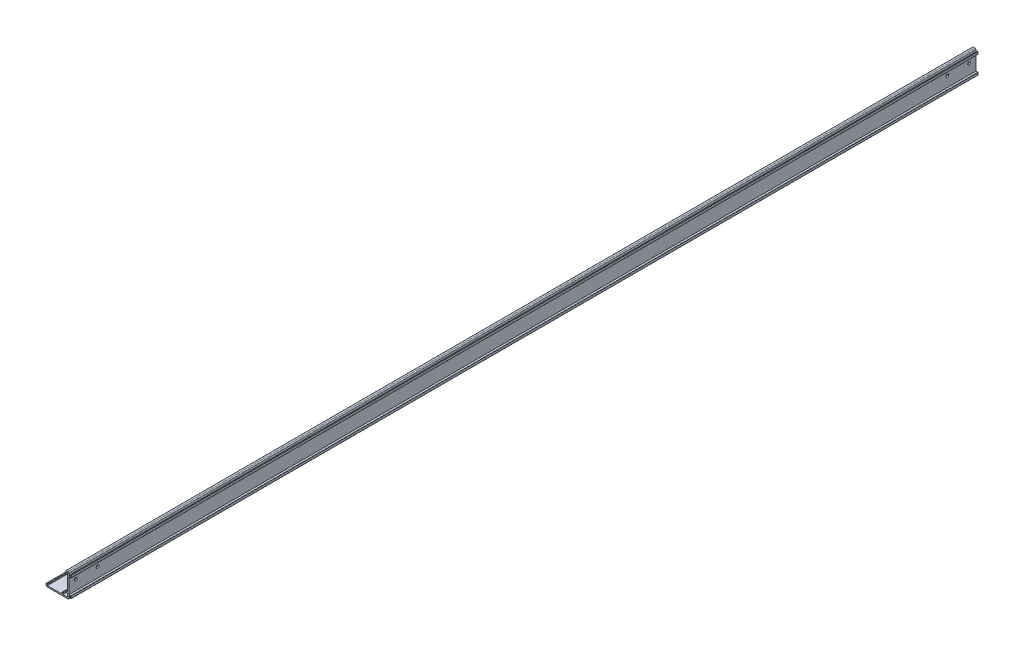
from build123d import *

# Parameters (mm, degrees)
MAIN_W                 = 46.736
MAIN_H                 = 1689.1
EXTRUDE_MAIN_DEPTH     = 44.45
MAIN_CUT_W             = 37.338
MAIN_CUT_H             = 39.37
CUT_MAIN_DEPTH         = 1690.846346839
BOTTOM_LEFT_W          = 26.67
BOTTOM_LEFT_H          = 2.667
CUT_BOTTOM_LEFT_DEPTH  = 1690.846346839
BOTTOM_RIGHT_W         = 6.096
BOTTOM_RIGHT_H         = 2.667
CUT_BOTTOM_RIGHT_DEPTH = 1690.846346839
LEFT_BOTTOM_W          = 3.048
LEFT_BOTTOM_H          = 6.858
CUT_LEFT_BOTTOM_DEPTH  = 1690.846346839
LEFT_MIDDLE_W          = 3.048
LEFT_MIDDLE_H          = 30.48
CUT_LEFT_MID_DEPTH     = 1690.846346839
RIGHT_MIDDLE_W         = 7.874
RIGHT_MIDDLE_H         = 28.702
CUT_RIGHT_MID_DEPTH    = 1690.846346839
HOOK_CUT_DEPTH         = 1690.846346839
FILLET3_R              = 1.905
FILLET4_R              = 0.508
SCREW_HOLES_D          = 5.3086


with BuildPart() as part:
    # Main → Extrude-Main (new body)
    with BuildSketch(Plane(origin=(0, 0, 0), x_dir=(1, 0, 0), z_dir=(0, 1, 0))):
        Rectangle(MAIN_W, MAIN_H)
    extrude(amount=EXTRUDE_MAIN_DEPTH)

    # Main Cut → Cut-Main (cut, through all)
    with BuildSketch(Plane.XY.offset(844.55)):
        with Locations((-4.699, 24.765)):
            Rectangle(MAIN_CUT_W, MAIN_CUT_H)
    extrude(amount=-CUT_MAIN_DEPTH, mode=Mode.SUBTRACT)

    # Bottom Left → Cut-Bottom Left (cut, through all)
    with BuildSketch(Plane.XY.offset(844.55)):
        with Locations((-7.493, 3.7465)):
            Rectangle(BOTTOM_LEFT_W, BOTTOM_LEFT_H)
    extrude(amount=-CUT_BOTTOM_LEFT_DEPTH, mode=Mode.SUBTRACT)

    # Bottom Right → Cut-Bottom Right (cut, through all)
    with BuildSketch(Plane.XY.offset(844.55)):
        with Locations((10.922, 3.7465)):
            Rectangle(BOTTOM_RIGHT_W, BOTTOM_RIGHT_H)
    extrude(amount=-CUT_BOTTOM_RIGHT_DEPTH, mode=Mode.SUBTRACT)

    # Left Bottom → Cut-Left Bottom (cut, through all)
    with BuildSketch(Plane.XY.offset(844.55)):
        with Locations((15.494, 5.842)):
            Rectangle(LEFT_BOTTOM_W, LEFT_BOTTOM_H)
    extrude(amount=-CUT_LEFT_BOTTOM_DEPTH, mode=Mode.SUBTRACT)

    # Left Middle → Cut-Left Mid (cut, through all)
    with BuildSketch(Plane.XY.offset(844.55)):
        with Locations((15.494, 26.730206209)):
            Rectangle(LEFT_MIDDLE_W, LEFT_MIDDLE_H)
    extrude(amount=-CUT_LEFT_MID_DEPTH, mode=Mode.SUBTRACT)

    # Right Middle → Cut-Right Mid (cut, through all)
    with BuildSketch(Plane.XY.offset(844.55)):
        with Locations((23.368, 22.225)):
            Rectangle(RIGHT_MIDDLE_W, RIGHT_MIDDLE_H)
    extrude(amount=-CUT_RIGHT_MID_DEPTH, mode=Mode.SUBTRACT)

    # Hooks → Hook Cut (cut, through all)
    with BuildSketch(Plane.XY.offset(844.55)):
        Polygon((19.431, 44.45), (19.431, 38.1635), (21.7805, 38.1635), (21.7805, 41.402), (23.368, 41.402), (23.368, 44.45), align=None)
        Polygon((23.368, 3.048), (23.368, 0), (19.431, 0), (19.431, 6.2865), (21.7805, 6.2865), (21.7805, 3.048), align=None)
    extrude(amount=-HOOK_CUT_DEPTH, mode=Mode.SUBTRACT)

    # Fillet3
    fillet3_edges = [part.edges().sort_by_distance(p)[0] for p in [
        (19.431, 44.45, 0),
        (19.431, 0, 0),
        (-23.368, 0, 0),
    ]]
    fillet(fillet3_edges, radius=FILLET3_R)

    # Fillet4
    fillet4_edges = [part.edges().sort_by_distance(p)[0] for p in [
        (23.368, 41.402, 0),
        (21.7805, 41.402, 0),
        (21.7805, 3.048, 0),
        (23.368, 3.048, 0),
        (-23.368, 5.08, 0),
        (13.97, 44.45, 0),
        (-20.828, 5.08, 0),
        (5.842, 5.08, 0),
        (7.874, 5.08, 0),
        (13.97, 9.271, 0),
        (13.97, 11.490206209, 0),
        (13.97, 41.970206209, 0),
        (23.368, 36.576, 0),
        (23.368, 7.874, 0),
    ]]
    fillet(fillet4_edges, radius=FILLET4_R)

    # Screw Holes (through all)
    with Locations(Plane.ZY.offset(-17.018)):
        with Locations((-791.21, 26.730206209), (831.85, 26.730206209), (791.21, 26.730206209), (-831.85, 26.730206209)):
            Hole(SCREW_HOLES_D / 2)


solid = part.part
